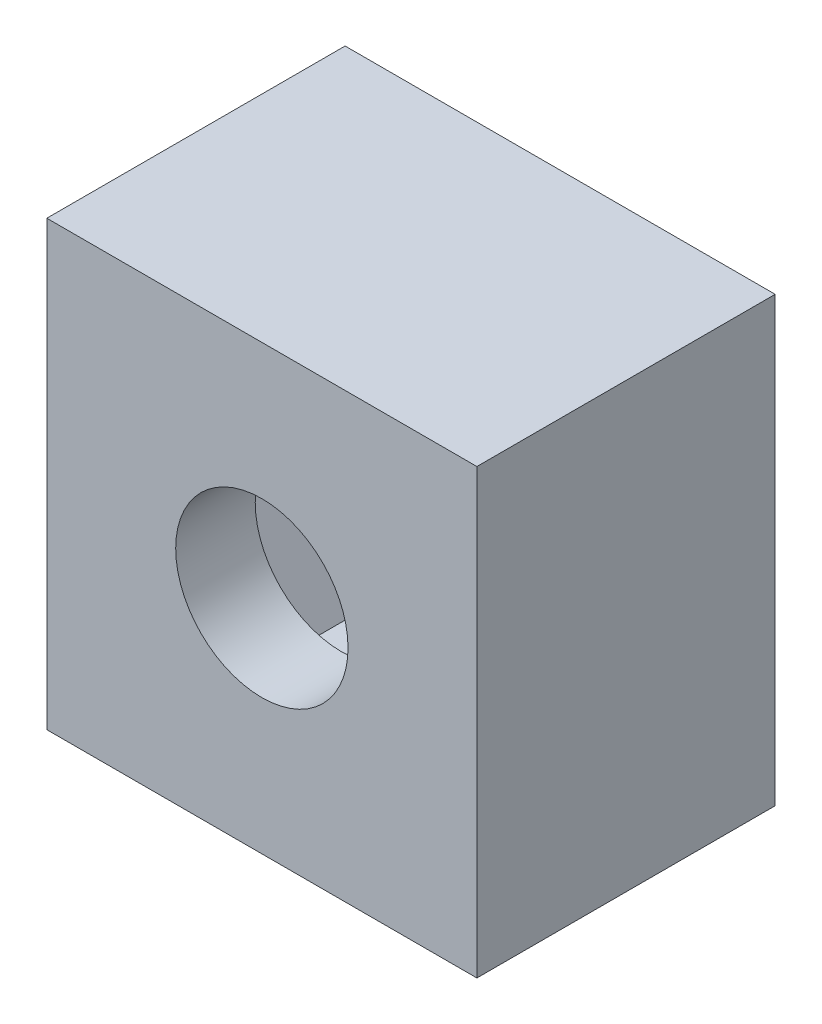
from build123d import *

# Parameters (mm, degrees)
SKETCH1_W           = 16.2205508
SKETCH1_H           = 16.7068193
BOSS_EXTRUDE1_DEPTH = 5.25
SKETCH2_W           = 16.2205508
SKETCH2_H           = 16.7068193
SKETCH2_R           = 3.25
BOSS_EXTRUDE2_DEPTH = 3
BOSS_EXTRUDE3_START = -3
SKETCH1_3_W         = 16.2205508
SKETCH1_3_H         = 16.7068193
SKETCH1_3_R         = 3.25
BOSS_EXTRUDE3_DEPTH = 3


with BuildPart() as part:
    # Sketch1 → Boss-Extrude1 (new body)
    with BuildSketch(Plane.XY):
        Rectangle(SKETCH1_W, SKETCH1_H)
        Polygon((3.127313958, 5.416666667), (6.254627916, 0), (3.127313958, -5.416666667), (-3.127313958, -5.416666667), (-6.254627916, 0), (-3.127313958, 5.416666667), align=None, mode=Mode.SUBTRACT)
    extrude(amount=BOSS_EXTRUDE1_DEPTH)

    # Sketch2 → Boss-Extrude2 (add)
    with BuildSketch(Plane.XY.offset(5.25)):
        Rectangle(SKETCH2_W, SKETCH2_H)
        Circle(SKETCH2_R, mode=Mode.SUBTRACT)
    extrude(amount=BOSS_EXTRUDE2_DEPTH)

    # Sketch1<3> → Boss-Extrude3 (add)
    with BuildSketch(Plane.XY.offset(BOSS_EXTRUDE3_START)):
        Rectangle(SKETCH1_3_W, SKETCH1_3_H)
        Circle(SKETCH1_3_R, mode=Mode.SUBTRACT)
    extrude(amount=BOSS_EXTRUDE3_DEPTH)


solid = part.part
